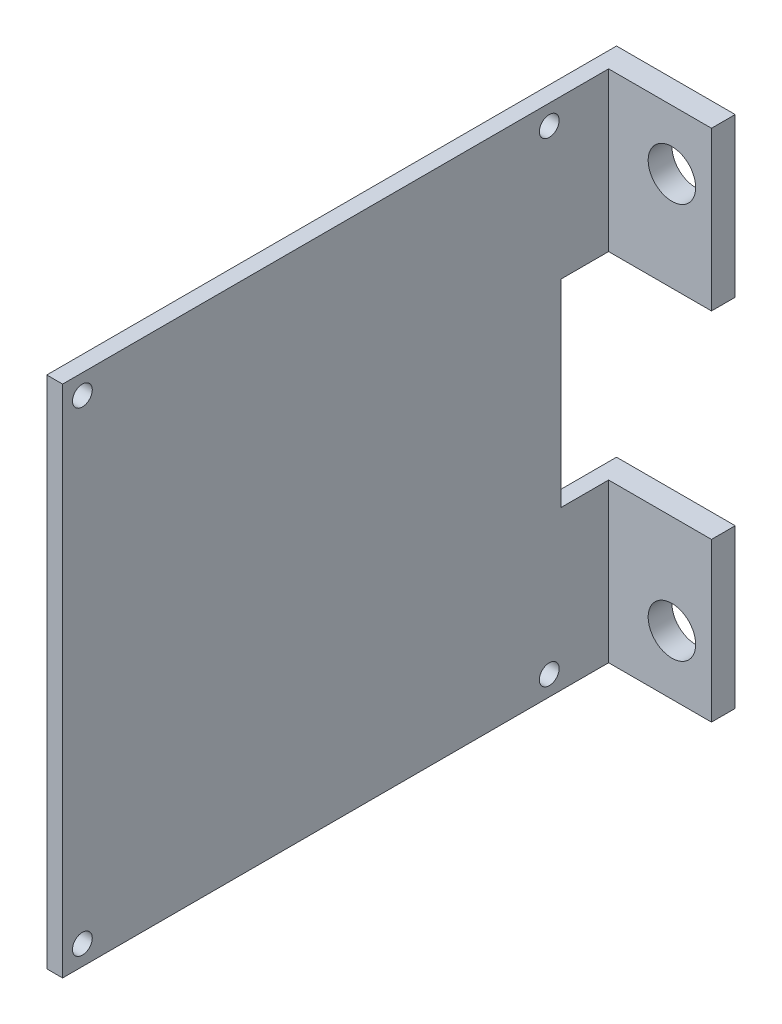
from build123d import *

# Parameters (mm, degrees)
SKETCH_1_W          = 15
SKETCH_1_H          = 65
EXTRUDE_1_DEPTH     = 3
SKETCH_2_R          = 3
SKETCH_2_W          = 15
SKETCH_2_H          = 25
CUT_EXTRUDE_1_DEPTH = 3
SKETCH_4_W          = 2
SKETCH_4_H          = 65
EXTRUDE_2_DEPTH     = 69
SKETCH_5_W          = 6
SKETCH_5_H          = 25
CUT_EXTRUDE_2_DEPTH = 69
SKETCH_6_R          = 1.25
CUT_EXTRUDE_3_DEPTH = 69


with BuildPart() as part:
    # 草圖1 → 填料-伸長1 (new body)
    with BuildSketch(Plane.XY):
        with Locations((7.5, 32.5)):
            Rectangle(SKETCH_1_W, SKETCH_1_H)
    extrude(amount=EXTRUDE_1_DEPTH)

    # 草圖2 → 除料-伸長1 (cut)
    with BuildSketch(Plane.XY.offset(3)):
        with Locations((10, 57.5)):
            Circle(SKETCH_2_R)
        with Locations((10, 7.5)):
            Circle(SKETCH_2_R)
        with Locations((7.5, 32.5)):
            Rectangle(SKETCH_2_W, SKETCH_2_H)
    extrude(amount=-CUT_EXTRUDE_1_DEPTH, mode=Mode.SUBTRACT)


with BuildPart() as cut_extrude_1_piece_1:
    # of the separate pieces the step leaves, piece 1, a body of its own (cut_extrude_1_pieces)
    add(part.part.solids().sort_by_distance((0, 0, 0))[0])



with BuildPart() as cut_extrude_1_piece_2:
    # of the separate pieces the step leaves, piece 2, a body of its own (cut_extrude_1_pieces)
    add(part.part.solids().sort_by_distance((0, 65, 0))[0])


with BuildPart() as cut_extrude_1_piece_1_1:
    add(cut_extrude_1_piece_1.part)

    add(cut_extrude_1_piece_2.part)  # 填料-伸長2 merges 除料-伸長1 piece 2
    # 草圖4 → 填料-伸長2 (add)
    with BuildSketch(Plane.XY.offset(3)):
        with Locations((1, 32.5)):
            Rectangle(SKETCH_4_W, SKETCH_4_H)
    extrude(amount=EXTRUDE_2_DEPTH)

    # 草圖5 → 除料-伸長2 (cut)
    with BuildSketch(Plane(origin=(2, 0, 0), x_dir=(0, 0, -1), z_dir=(1, 0, 0))):
        with Locations((-6, 32.5)):
            Rectangle(SKETCH_5_W, SKETCH_5_H)
    extrude(amount=-CUT_EXTRUDE_2_DEPTH, mode=Mode.SUBTRACT)

    # 草圖6 → 除料-伸長3 (cut)
    with BuildSketch(Plane(origin=(2, 0, 0), x_dir=(0, 0, -1), z_dir=(1, 0, 0))):
        with Locations(Location((-69.5, 62.5, 0), (0, 0, 90))):
            Circle(SKETCH_6_R)
        with Locations(Location((-10.5, 62.5, 0), (0, 0, 90))):
            Circle(SKETCH_6_R)
        with Locations(Location((-69.5, 2.5, 0), (0, 0, 90))):
            Circle(SKETCH_6_R)
        with Locations(Location((-10.5, 2.5, 0), (0, 0, 90))):
            Circle(SKETCH_6_R)
    extrude(amount=-CUT_EXTRUDE_3_DEPTH, mode=Mode.SUBTRACT)


solid = cut_extrude_1_piece_1_1.part
